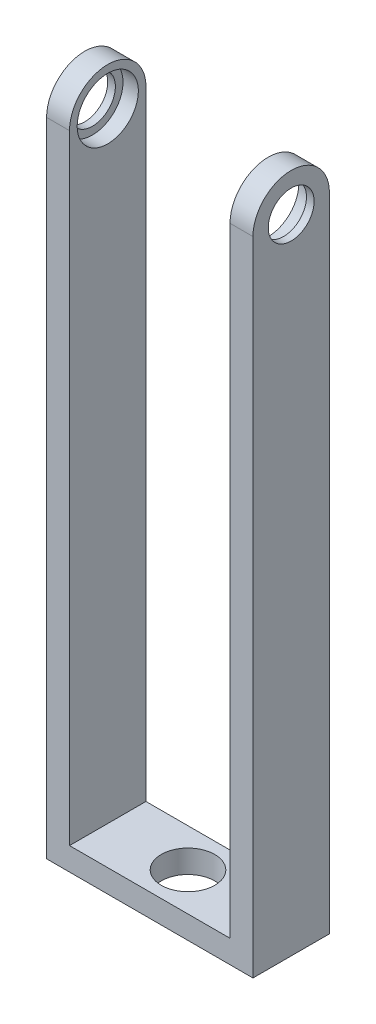
from build123d import *

# Parameters (mm, degrees)
SKETCH1_W           = 27
SKETCH1_H           = 10
BOSS_EXTRUDE1_DEPTH = 3
SKETCH5_R           = 3
BOSS_EXTRUDE3_DEPTH = 3
SKETCH6_R           = 1.5
CUT_EXTRUDE1_DEPTH  = 3
SKETCH7_R           = 4
CUT_EXTRUDE2_DEPTH  = 2
SKETCH8_R           = 3.5
CUT_EXTRUDE4_DEPTH  = 88.196616907


with BuildPart() as part:
    # Sketch1 → Boss-Extrude1 (new body)
    with BuildSketch(Plane(origin=(0, 0, 0), x_dir=(1, 0, 0), z_dir=(0, 1, 0))):
        Rectangle(SKETCH1_W, SKETCH1_H)
    boss_extrude1 = extrude(amount=BOSS_EXTRUDE1_DEPTH)

    # Sketch5 → Boss-Extrude3 (add)
    with BuildSketch(Plane(origin=(13.5, 0, 0), x_dir=(0, 0, -1), z_dir=(1, 0, 0))):
        with BuildLine():
            Line((-5, 3), (5, 3))
            Line((5, 3), (5, 84))
            ThreePointArc((5, 84), (0, 89), (-5, 84))
            Line((-5, 84), (-5, 3))
        make_face()
        with Locations((0, 84)):
            Circle(SKETCH5_R, mode=Mode.SUBTRACT)
    boss_extrude3 = extrude(amount=-BOSS_EXTRUDE3_DEPTH)

    # Sketch6 → Cut-Extrude1 (cut)
    with BuildSketch(Plane(origin=(0, 3, 0), x_dir=(1, 0, 0), z_dir=(0, 1, 0))):
        with Locations(Location((0, 0, 0), (0, 0, 270))):
            Circle(SKETCH6_R)
    extrude(amount=-CUT_EXTRUDE1_DEPTH, mode=Mode.SUBTRACT)

    # Sketch7 → Cut-Extrude2 (cut)
    with BuildSketch(Plane.ZY.offset(-10.5)):
        with Locations((0, 84)):
            Circle(SKETCH7_R)
    cut_extrude2 = extrude(amount=-CUT_EXTRUDE2_DEPTH, mode=Mode.SUBTRACT)

    # Mirror3: Boss-Extrude1, Boss-Extrude3, Cut-Extrude2 across plane
    add(boss_extrude1.mirror(Plane(origin=(0, 0, 0), x_dir=(0, 0, 1), z_dir=(1, 0, 0))))
    add(boss_extrude3.mirror(Plane(origin=(0, 0, 0), x_dir=(0, 0, 1), z_dir=(1, 0, 0))))
    add(cut_extrude2.mirror(Plane(origin=(0, 0, 0), x_dir=(0, 0, 1), z_dir=(1, 0, 0))), mode=Mode.SUBTRACT)

    # Sketch8 → Cut-Extrude4 (cut, through all)
    with BuildSketch(Plane(origin=(0, 3, 0), x_dir=(1, 0, 0), z_dir=(0, 1, 0))):
        with Locations(Location((0, 0, 0), (0, 0, 270))):
            Circle(SKETCH8_R)
    extrude(amount=-CUT_EXTRUDE4_DEPTH, mode=Mode.SUBTRACT)


solid = part.part
